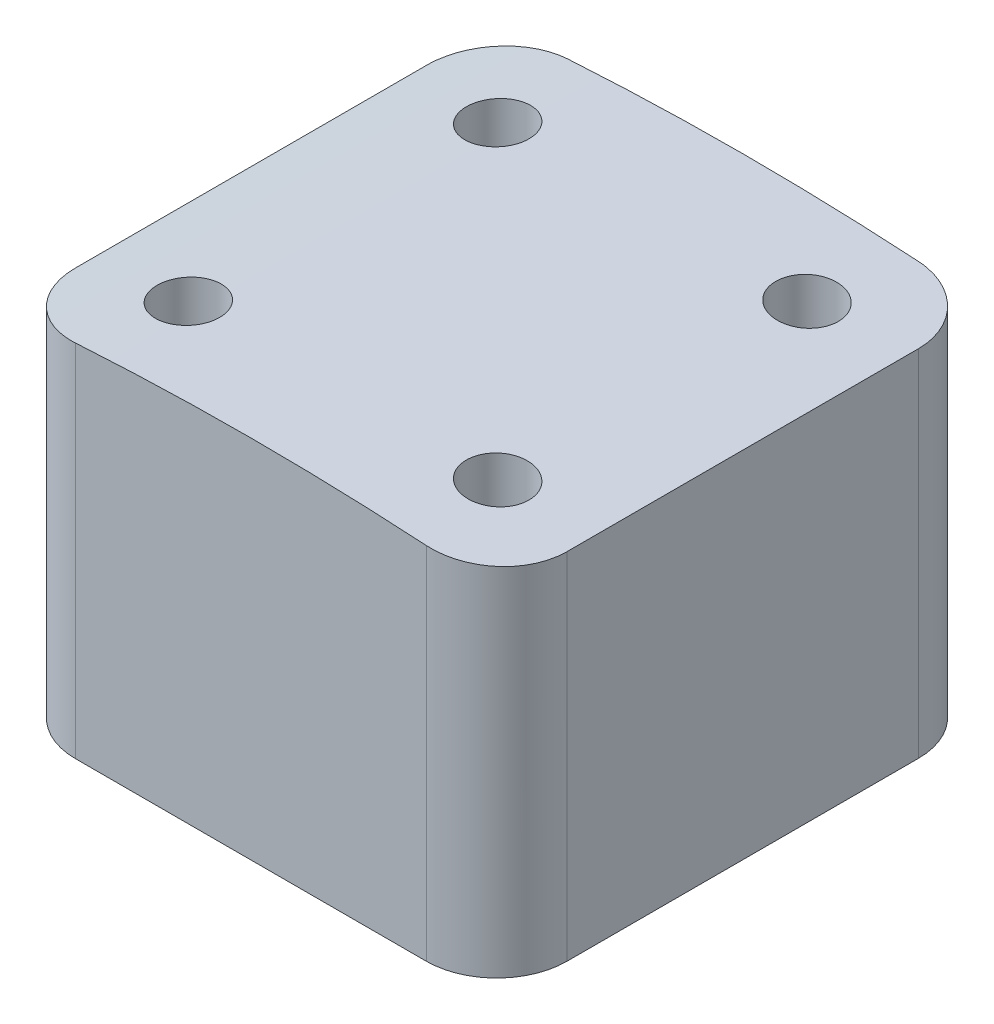
from build123d import *

# Parameters (mm, degrees)
BOSS_EXTRUDE1_DEPTH             = 8.89
BOSS_EXTRUDE1_DEPTH_BACK        = 8.89
F_1_4_0_25_DIAMETER_SLOT1_D     = 6.35
F_1_4_0_25_DIAMETER_SLOT1_DEPTH = 9.525
F_1_4_0_25_DIAMETER_SLOT1_TIP   = 1.907732465
TAP_DRILL_FOR_4_40_TAP1_D       = 2.2606
FILLET1_R                       = 2.54


with BuildPart() as part:
    # Sketch1 → Boss-Extrude1 (new, two sides: drawn at the far end of the back side and taken through both)
    with BuildSketch(Plane.XY.offset(-BOSS_EXTRUDE1_DEPTH_BACK)):
        with BuildLine():
            Line((8.853671113, 101.352246104), (8.853671113, 88.534433979))
            Line((8.853671113, 88.534433979), (-8.902635044, 88.534433979))
            Line((-8.902635044, 88.534433979), (-8.902635044, 101.350105765))
            ThreePointArc((-8.902635044, 101.350105765), (-0.024528813, 101.739820854), (8.853671113, 101.352246104))
        make_face()
    extrude(amount=BOSS_EXTRUDE1_DEPTH + BOSS_EXTRUDE1_DEPTH_BACK)

    # 1/4 (0.25) Diameter Slot1
    with Locations(Plane(origin=(0, 88.534433979, 0), x_dir=(-1, 0, 0), z_dir=(0, -1, 0))):
        with Locations((0, 0)):
            Hole(F_1_4_0_25_DIAMETER_SLOT1_D / 2, depth=F_1_4_0_25_DIAMETER_SLOT1_DEPTH)
            with Locations((0, 0, -(F_1_4_0_25_DIAMETER_SLOT1_DEPTH + F_1_4_0_25_DIAMETER_SLOT1_TIP / 2))):  # 118° drill point
                Cone(0, F_1_4_0_25_DIAMETER_SLOT1_D / 2, F_1_4_0_25_DIAMETER_SLOT1_TIP, mode=Mode.SUBTRACT)

    # Tap Drill for #4-40 Tap1 (through all)
    with Locations(Plane(origin=(0, 88.534433979, 0), x_dir=(-1, 0, 0), z_dir=(0, -1, 0))):
        with Locations((-5.588, 5.588), (5.588, 5.588), (5.588, -5.588), (-5.588, -5.588)):
            Hole(TAP_DRILL_FOR_4_40_TAP1_D / 2)

    # Fillet1
    fillet1_edges = [part.edges().sort_by_distance(p)[0] for p in [
        (-8.902635044, 94.942269872, 8.89),
        (8.853671113, 94.943340042, -8.89),
        (8.853671113, 94.943340042, 8.89),
        (-8.902635044, 94.942269872, -8.89),
    ]]
    fillet(fillet1_edges, radius=FILLET1_R)


solid = part.part
